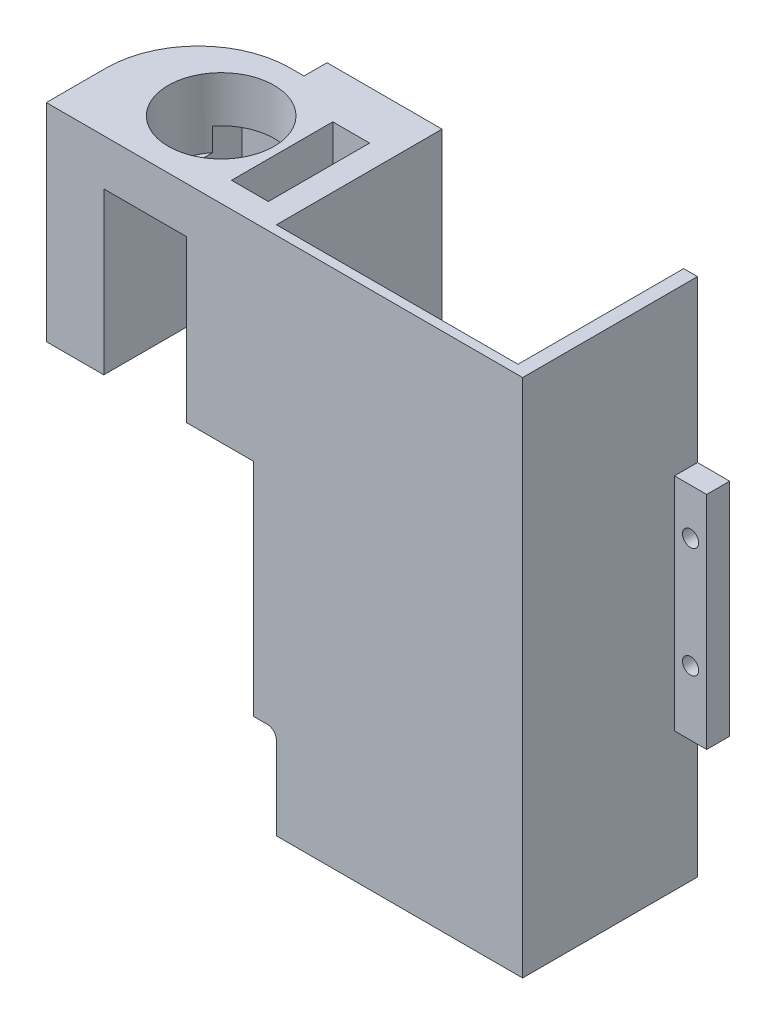
from build123d import *

# Parameters (mm, degrees)
SKETCH_1_W          = 58.5
SKETCH_1_H          = 42
EXTRUDE_1_DEPTH     = 123
CUT_EXTRUDE_1_DEPTH = 120
SKETCH_3_W          = 58.5
SKETCH_3_H          = 123
CUT_EXTRUDE_2_DEPTH = 4
SKETCH_4_W          = 52.5
SKETCH_4_H          = 120
CUT_EXTRUDE_3_DEPTH = 1
SKETCH_5_W          = 58.5
SKETCH_5_H          = 38
CUT_EXTRUDE_4_DEPTH = 10
SKETCH_6_W          = 7
SKETCH_6_H          = 113
EXTRUDE_2_DEPTH     = 5
SKETCH_10_W         = 3
SKETCH_10_H         = 20
CUT_EXTRUDE_5_DEPTH = 33
HOLE_WIZARD_2_D     = 3.5
SKETCH_13_W         = 7
SKETCH_13_H         = 113
EXTRUDE_3_DEPTH     = 5
HOLE_WIZARD_3_D     = 3.5
SKETCH_17_W         = 7
SKETCH_17_H         = 35
SKETCH_17_H_2       = 30
CUT_EXTRUDE_6_DEPTH = 5
SKETCH_18_W         = 3
SKETCH_18_H         = 20
EXTRUDE_4_DEPTH     = 5
SKETCH_19_W         = 28
SKETCH_19_H         = 20
CUT_EXTRUDE_7_DEPTH = 2
FILLET_3_R          = 2
SKETCH_21_W         = 33
SKETCH_21_H         = 30
EXTRUDE_6_DEPTH     = 30
SKETCH_22_W         = 15
SKETCH_22_H         = 33
EXTRUDE_7_DEPTH     = 30
SKETCH_24_W         = 18
SKETCH_24_H         = 20
CUT_EXTRUDE_8_DEPTH = 30
HOLE_WIZARD_4_D     = 23
HOLE_WIZARD_4_DEPTH = 15
SKETCH_27_W         = 15
SKETCH_27_H         = 60
EXTRUDE_8_DEPTH     = 5
SKETCH_28_W         = 45
SKETCH_28_H         = 3
EXTRUDE_9_DEPTH     = 15
SKETCH_29_W         = 14.5
SKETCH_29_H         = 30
SKETCH_29_W_2       = 12.5
EXTRUDE_10_DEPTH    = 15
FILLET_6_R          = 20
SKETCH_30_W         = 2
SKETCH_30_H         = 22
CUT_EXTRUDE_9_DEPTH = 102.775488208


with BuildPart() as part:
    # 草图1 → 凸台-拉伸1 (new body)
    with BuildSketch(Plane(origin=(0, 0, 0), x_dir=(1, 0, 0), z_dir=(0, 1, 0))):
        with Locations((29.25, 21)):
            Rectangle(SKETCH_1_W, SKETCH_1_H)
    extrude(amount=EXTRUDE_1_DEPTH)

    # 草图2 → 切除-拉伸1 (cut)
    with BuildSketch(Plane(origin=(0, 123, 0), x_dir=(1, 0, 0), z_dir=(0, 1, 0))):
        Polygon((3, 3), (4.178571429, 3), (54.321428571, 39), (3, 39), align=None)
        Polygon((54.321428571, 39), (4.178571429, 3), (55.5, 3), (55.5, 39), align=None)
    extrude(amount=-CUT_EXTRUDE_1_DEPTH, mode=Mode.SUBTRACT)

    # 草图3 → 切除-拉伸2 (cut)
    with BuildSketch(Plane(origin=(0, 0, -42), x_dir=(-1, 0, 0), z_dir=(0, 0, -1))):
        with Locations((-29.25, 61.5)):
            Rectangle(SKETCH_3_W, SKETCH_3_H)
    extrude(amount=-CUT_EXTRUDE_2_DEPTH, mode=Mode.SUBTRACT)

    # 草图4 → 切除-拉伸3 (cut)
    with BuildSketch(Plane(origin=(0, 0, -3), x_dir=(-1, 0, 0), z_dir=(0, 0, -1))):
        with Locations((-29.25, 63)):
            Rectangle(SKETCH_4_W, SKETCH_4_H)
    extrude(amount=-CUT_EXTRUDE_3_DEPTH, mode=Mode.SUBTRACT)

    # 草图5 → 切除-拉伸4 (cut)
    with BuildSketch(Plane(origin=(0, 123, 0), x_dir=(1, 0, 0), z_dir=(0, 1, 0))):
        with Locations((29.25, 19)):
            Rectangle(SKETCH_5_W, SKETCH_5_H)
    extrude(amount=-CUT_EXTRUDE_4_DEPTH, mode=Mode.SUBTRACT)

    # 草图6 → 凸台-拉伸2 (add)
    with BuildSketch(Plane(origin=(0, 0, -38), x_dir=(-1, 0, 0), z_dir=(0, 0, -1))):
        with Locations((3.5, 56.5)):
            Rectangle(SKETCH_6_W, SKETCH_6_H)
    extrude(amount=-EXTRUDE_2_DEPTH)

    # 草图10 → 切除-拉伸5 (cut)
    with BuildSketch(Plane.XY):
        with Locations((1.5, 10)):
            Rectangle(SKETCH_10_W, SKETCH_10_H)
    extrude(amount=-CUT_EXTRUDE_5_DEPTH, mode=Mode.SUBTRACT)

    # 孔2 (through all)
    with Locations(Plane.XY.offset(-33)):
        with Locations((-3.5, 40.5), (-3.5, 8)):
            Hole(HOLE_WIZARD_2_D / 2)

    # 草图13 → 凸台-拉伸3 (add)
    with BuildSketch(Plane(origin=(0, 0, -38), x_dir=(-1, 0, 0), z_dir=(0, 0, -1))):
        with Locations((-62, 56.5)):
            Rectangle(SKETCH_13_W, SKETCH_13_H)
    extrude(amount=-EXTRUDE_3_DEPTH)

    # 孔3 (through all)
    with Locations(Plane.XY.offset(-33)):
        with Locations((62, 68), (62, 44)):
            Hole(HOLE_WIZARD_3_D / 2)

    # 草图17 → 切除-拉伸6 (cut)
    with BuildSketch(Plane.XY.offset(-33)):
        with Locations((62, 95.5)):
            Rectangle(SKETCH_17_W, SKETCH_17_H)
        with Locations((62, 15)):
            Rectangle(SKETCH_17_W, SKETCH_17_H_2)
    extrude(amount=-CUT_EXTRUDE_6_DEPTH, mode=Mode.SUBTRACT)

    # 草图18 → 凸台-拉伸4 (add)
    with BuildSketch(Plane.XY.offset(-33)):
        with Locations((1.5, 10)):
            Rectangle(SKETCH_18_W, SKETCH_18_H)
    extrude(amount=EXTRUDE_4_DEPTH)

    # 草图19 → 切除-拉伸7 (cut)
    with BuildSketch(Plane.ZY.offset(-3)):
        with Locations((-14, 10)):
            Rectangle(SKETCH_19_W, SKETCH_19_H)
    extrude(amount=-CUT_EXTRUDE_7_DEPTH, mode=Mode.SUBTRACT)

    # 圆角3
    fillet_3_edges = [part.edges().sort_by_distance(p)[0] for p in [
        (5, 20, -1),
    ]]
    fillet(fillet_3_edges, radius=FILLET_3_R)

    # 草图21 → 凸台-拉伸6 (add)
    with BuildSketch(Plane.ZY):
        with Locations((-16.5, 98)):
            Rectangle(SKETCH_21_W, SKETCH_21_H)
    extrude(amount=EXTRUDE_6_DEPTH)

    # 草图22 → 凸台-拉伸7 (add)
    with BuildSketch(Plane(origin=(0, 113, 0), x_dir=(1, 0, 0), z_dir=(0, 1, 0))):
        with Locations((-37.5, 16.5)):
            Rectangle(SKETCH_22_W, SKETCH_22_H)
    extrude(amount=-EXTRUDE_7_DEPTH)

    # 草图24 → 切除-拉伸8 (cut)
    with BuildSketch(Plane.XY):
        with Locations((-23.5, 93)):
            Rectangle(SKETCH_24_W, SKETCH_24_H)
    extrude(amount=-CUT_EXTRUDE_8_DEPTH, mode=Mode.SUBTRACT)

    # 孔4
    with Locations(Plane(origin=(0, 113, 0), x_dir=(1, 0, 0), z_dir=(0, 1, 0))):
        with Locations((-23.5, 16.5)):
            Hole(HOLE_WIZARD_4_D / 2, depth=HOLE_WIZARD_4_DEPTH)

    # 草图27 → 凸台-拉伸8 (add)
    with BuildSketch(Plane(origin=(0, 0, -33), x_dir=(-1, 0, 0), z_dir=(0, 0, -1))):
        with Locations((14.5, 83)):
            Rectangle(SKETCH_27_W, SKETCH_27_H)
    extrude(amount=EXTRUDE_8_DEPTH)

    # 草图28 → 凸台-拉伸9 (add)
    with BuildSketch(Plane(origin=(0, 83, 0), x_dir=(-1, 0, 0), z_dir=(0, -1, 0))):
        with Locations((22.5, 31.5)):
            Rectangle(SKETCH_28_W, SKETCH_28_H)
    extrude(amount=EXTRUDE_9_DEPTH)

    # 草图29 → 凸台-拉伸10 (add)
    with BuildSketch(Plane.XZ.offset(-83)):
        with Locations((-7.25, -15)):
            Rectangle(SKETCH_29_W, SKETCH_29_H)
        with Locations((-38.75, -15)):
            Rectangle(SKETCH_29_W_2, SKETCH_29_H)
    extrude(amount=EXTRUDE_10_DEPTH)

    # 圆角6
    fillet_6_edges = [part.edges().sort_by_distance(p)[0] for p in [
        (-45, 90.5, -33),
    ]]
    fillet(fillet_6_edges, radius=FILLET_6_R)

    # 草图30 → 切除-拉伸9 (cut, through all)
    with BuildSketch(Plane.XZ.offset(-68)):
        Polygon((-10.25, -9.672413793), (-4.25, -23.327586207), (-4.25, -5.5), (-10.25, -5.5), align=None)
        Polygon((-4.25, -27.5), (-4.25, -23.327586207), (-10.25, -9.672413793), (-10.25, -27.5), align=None)
        with Locations((-3.25, -16.5)):
            Rectangle(SKETCH_30_W, SKETCH_30_H)
    extrude(amount=-CUT_EXTRUDE_9_DEPTH, mode=Mode.SUBTRACT)


solid = part.part
